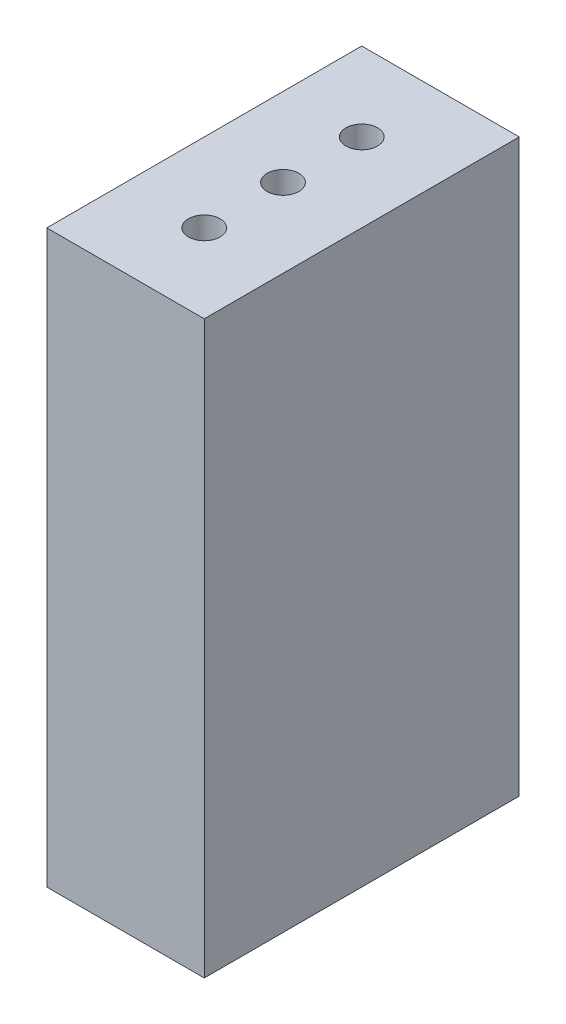
from build123d import *

# Parameters (mm, degrees)
SKETCH1_W                   = 25.4
SKETCH1_H                   = 50.8
BOSS_EXTRUDE1_DEPTH         = 92.075
F_1_4_20_TAPPED_HOLE3_D     = 5.1054
F_1_4_20_TAPPED_HOLE3_DEPTH = 16.51
F_1_4_20_TAPPED_HOLE3_TIP   = 1.533816902


with BuildPart() as part:
    # Sketch1 → Boss-Extrude1 (new body)
    with BuildSketch(Plane(origin=(0, 0, 0), x_dir=(1, 0, 0), z_dir=(0, 1, 0))):
        Rectangle(SKETCH1_W, SKETCH1_H)
    extrude(amount=BOSS_EXTRUDE1_DEPTH)

    # 1/4-20 Tapped Hole3
    with Locations(Plane(origin=(0, 92.075, 0), x_dir=(1, 0, 0), z_dir=(0, 1, 0))):
        with Locations((0, 12.7), (0, 0), (0, -12.7)):
            Hole(F_1_4_20_TAPPED_HOLE3_D / 2, depth=F_1_4_20_TAPPED_HOLE3_DEPTH)
            with Locations((0, 0, -(F_1_4_20_TAPPED_HOLE3_DEPTH + F_1_4_20_TAPPED_HOLE3_TIP / 2))):  # 118° drill point
                Cone(0, F_1_4_20_TAPPED_HOLE3_D / 2, F_1_4_20_TAPPED_HOLE3_TIP, mode=Mode.SUBTRACT)


solid = part.part
